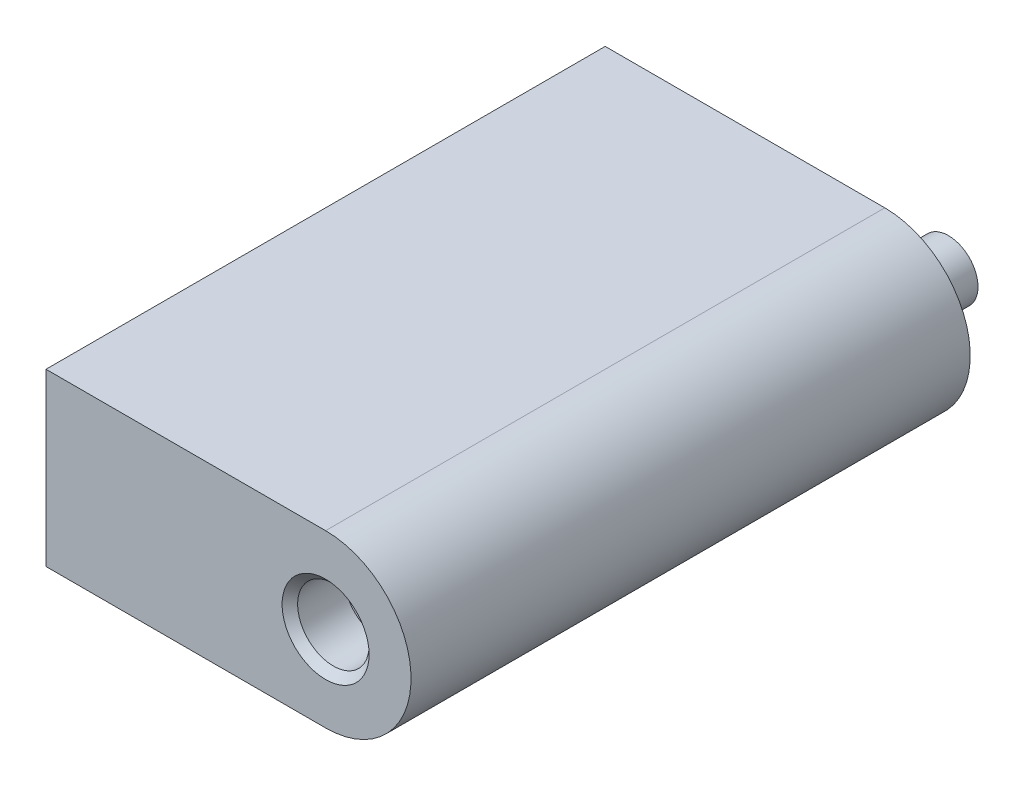
from build123d import *

# Parameters (mm, degrees)
BOSS_EXTRU_1_DEPTH      = 36
ESQUISSE2_W             = 27
ESQUISSE2_H             = 9
ENL_V_MAT_EXTRU_1_DEPTH = 9
ESQUISSE3_R             = 2.3
ENL_V_MAT_EXTRU_2_DEPTH = 3.5
ESQUISSE4_R             = 1.9
BOSS_EXTRU_2_DEPTH      = 4.1
CONG_1_R                = 1
CHANFREIN1_SIZE         = 0.5
CHANFREIN2_SIZE         = 0.5


with BuildPart() as part:
    # Esquisse1 → Boss.-Extru.1 (new body)
    with BuildSketch(Plane.XY):
        with BuildLine():
            Line((0, 5.5), (-18, 5.5))
            Line((-18, 5.5), (-18, -5.5))
            Line((-18, -5.5), (0, -5.5))
            ThreePointArc((0, -5.5), (5.5, 0), (0, 5.5))
        make_face()
    extrude(amount=BOSS_EXTRU_1_DEPTH)

    # Esquisse2 → Enlèv. mat.-Extru.1 (cut)
    with BuildSketch(Plane.ZY.offset(18)):
        with Locations((18.047533914, 0)):
            Rectangle(ESQUISSE2_W, ESQUISSE2_H)
    extrude(amount=-ENL_V_MAT_EXTRU_1_DEPTH, mode=Mode.SUBTRACT)

    # Esquisse3 → Enlèv. mat.-Extru.2 (cut)
    with BuildSketch(Plane.XY.offset(36)):
        Circle(ESQUISSE3_R)
    extrude(amount=-ENL_V_MAT_EXTRU_2_DEPTH, mode=Mode.SUBTRACT)

    # Esquisse4 → Boss.-Extru.2 (add)
    with BuildSketch(Plane(origin=(0, 0, 0), x_dir=(-1, 0, 0), z_dir=(0, 0, -1))):
        with Locations(Location((0, 0, 0), (0, 0, 180))):
            Circle(ESQUISSE4_R)
    extrude(amount=BOSS_EXTRU_2_DEPTH)

    # Congé1
    cong_1_edges = [part.edges().sort_by_distance(p)[0] for p in [
        (-1.9, 0, 0),
    ]]
    fillet(cong_1_edges, radius=CONG_1_R)

    # Chanfrein1
    chanfrein1_edges = [part.edges().sort_by_distance(p)[0] for p in [
        (-2.3, 0, 36),
    ]]
    chamfer(chanfrein1_edges, length=CHANFREIN1_SIZE)

    # Chanfrein2
    chanfrein2_edges = [part.edges().sort_by_distance(p)[0] for p in [
        (-18, 0, 4.547533914),
        (-18, -4.5, 18.047533914),
        (-18, 0, 31.547533914),
        (-18, 4.5, 18.047533914),
    ]]
    chamfer(chanfrein2_edges, length=CHANFREIN2_SIZE)


solid = part.part
